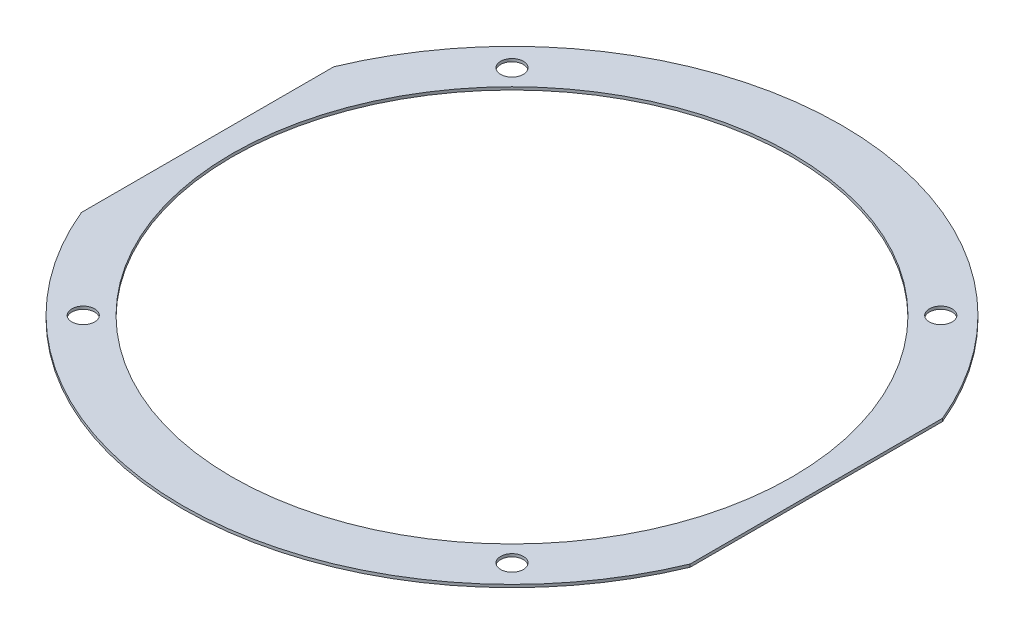
from build123d import *

# Parameters (mm, degrees)
SKETCH1_R           = 1
SKETCH1_R_2         = 24.607140245
BOSS_EXTRUDE1_DEPTH = 0.25


with BuildPart() as part:
    # Sketch1 → Boss-Extrude1 (new body)
    with BuildSketch(Plane(origin=(0, 0, 0), x_dir=(1, 0, 0), z_dir=(0, 1, 0))):
        with BuildLine():
            Line((-26.75, 11.088438625), (-26.75, -11.088438625))
            ThreePointArc((-26.75, -11.088438625), (0, -28.957140245), (26.75, -11.088438625))
            Line((26.75, -11.088438625), (26.75, 11.088438625))
            ThreePointArc((26.75, 11.088438625), (0, 28.957140245), (-26.75, 11.088438625))
        make_face()
        with Locations(Location((18.839877725, -18.839877725, 0), (0, 0, 270))):
            Circle(SKETCH1_R, mode=Mode.SUBTRACT)
        with Locations(Location((18.839877725, 18.839877725, 0), (0, 0, 270))):
            Circle(SKETCH1_R, mode=Mode.SUBTRACT)
        with Locations(Location((-18.839877725, 18.839877725, 0), (0, 0, 270))):
            Circle(SKETCH1_R, mode=Mode.SUBTRACT)
        with Locations(Location((-18.839877725, -18.839877725, 0), (0, 0, 270))):
            Circle(SKETCH1_R, mode=Mode.SUBTRACT)
        with Locations(Location((0, 0, 0), (0, 0, 270))):
            Circle(SKETCH1_R_2, mode=Mode.SUBTRACT)
    extrude(amount=BOSS_EXTRUDE1_DEPTH)


solid = part.part
